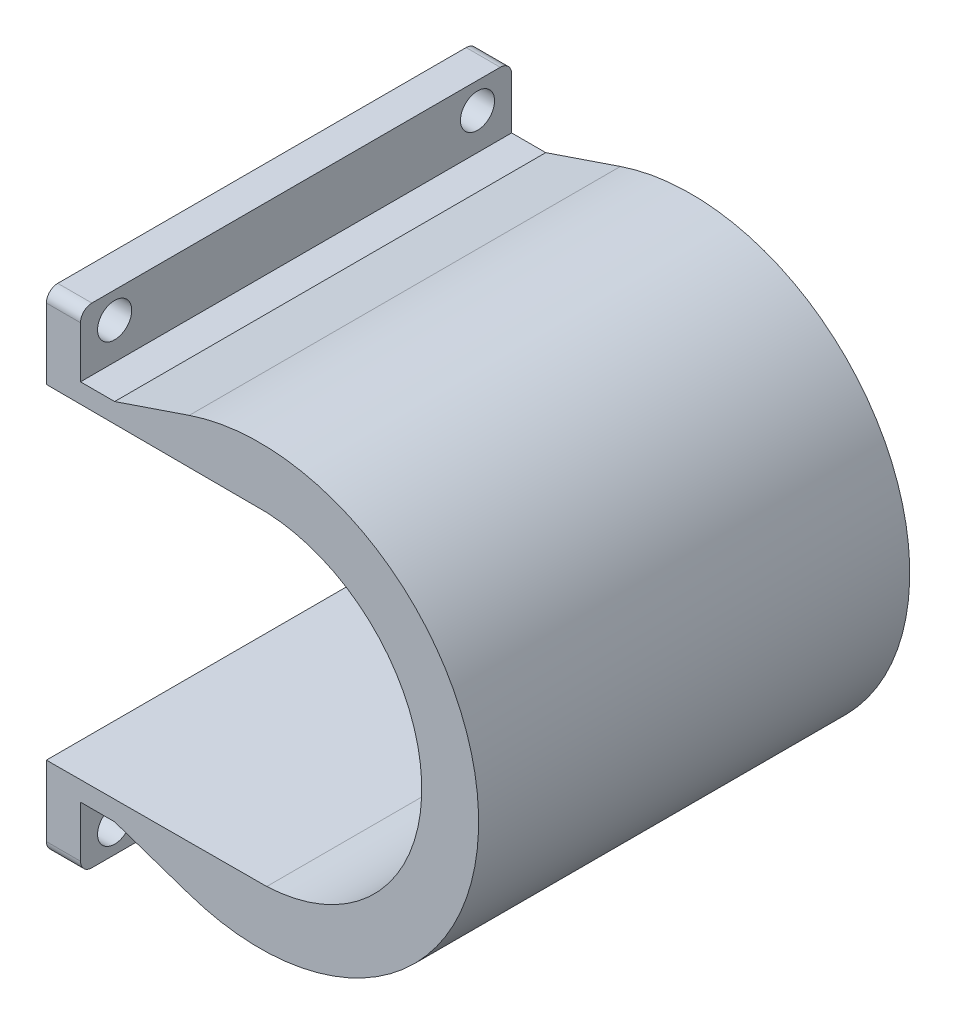
from build123d import *

# Parameters (mm, degrees)
EXTRUDE_1_DEPTH     = 37.9
CUT_EXTRUDE_1_REACH = 70.771
SKETCH_2_R          = 1.5
FILLET_1_R          = 1


with BuildPart() as part:
    # 草图1 → 凸台-拉伸1 (new body)
    with BuildSketch(Plane.XY):
        with BuildLine():
            Line((0, 0), (0, -7.2))
            Line((0, -7.2), (19.37157627, -7.263562842))
            ThreePointArc((19.37157627, -7.263562842), (33, -21.5), (19.37157627, -35.736437158))
            Line((19.37157627, -35.736437158), (0, -35.8))
            Line((0, -35.8), (0, -43))
            Line((0, -43), (3, -43))
            Line((3, -43), (3, -37.5))
            Line((3, -37.5), (6, -37.5))
            Line((6, -37.5), (12.56027856, -39.727721978))
            ThreePointArc((12.56027856, -39.727721978), (38, -21.5), (12.56027856, -3.272278022))
            Line((12.56027856, -3.272278022), (6, -5.5))
            Line((6, -5.5), (3, -5.5))
            Line((3, -5.5), (3, 0))
            Line((3, 0), (0, 0))
        make_face()
    extrude(amount=EXTRUDE_1_DEPTH)

    # 草图2 → 切除-拉伸1 (cut, up to next)
    with BuildSketch(Plane.ZY, mode=Mode.PRIVATE) as cut_extrude_1_sk1:
        with Locations((3, -2.3)):
            Circle(SKETCH_2_R)
    cut_extrude_1_tool1 = extrude(cut_extrude_1_sk1.sketch, amount=-CUT_EXTRUDE_1_REACH, mode=Mode.PRIVATE) & part.part
    # 草图2 → 切除-拉伸1 (cut, up to next)
    with BuildSketch(Plane.ZY, mode=Mode.PRIVATE) as cut_extrude_1_sk2:
        with Locations(Location((34.9, -2.3, 0), (0, 0, 270))):
            Circle(SKETCH_2_R)
    cut_extrude_1_tool2 = extrude(cut_extrude_1_sk2.sketch, amount=-CUT_EXTRUDE_1_REACH, mode=Mode.PRIVATE) & part.part
    # 草图2 → 切除-拉伸1 (cut, up to next)
    with BuildSketch(Plane.ZY, mode=Mode.PRIVATE) as cut_extrude_1_sk3:
        with Locations(Location((3, -40.7, 0), (0, 0, 270))):
            Circle(SKETCH_2_R)
    cut_extrude_1_tool3 = extrude(cut_extrude_1_sk3.sketch, amount=-CUT_EXTRUDE_1_REACH, mode=Mode.PRIVATE) & part.part
    # 草图2 → 切除-拉伸1 (cut, up to next)
    with BuildSketch(Plane.ZY, mode=Mode.PRIVATE) as cut_extrude_1_sk4:
        with Locations((34.9, -40.7)):
            Circle(SKETCH_2_R)
    cut_extrude_1_tool4 = extrude(cut_extrude_1_sk4.sketch, amount=-CUT_EXTRUDE_1_REACH, mode=Mode.PRIVATE) & part.part
    add(cut_extrude_1_tool1.solids().sort_by_distance((0, -2.3, 3))[0], mode=Mode.SUBTRACT)
    add(cut_extrude_1_tool2.solids().sort_by_distance((0, -2.3, 34.9))[0], mode=Mode.SUBTRACT)
    add(cut_extrude_1_tool3.solids().sort_by_distance((0, -40.7, 3))[0], mode=Mode.SUBTRACT)
    add(cut_extrude_1_tool4.solids().sort_by_distance((0, -40.7, 34.9))[0], mode=Mode.SUBTRACT)

    # 圆角1
    fillet_1_edges = [part.edges().sort_by_distance(p)[0] for p in [
        (1.5, -43, 0),
        (1.5, 0, 0),
        (1.5, -43, 37.9),
        (1.5, 0, 37.9),
    ]]
    fillet(fillet_1_edges, radius=FILLET_1_R)


solid = part.part
